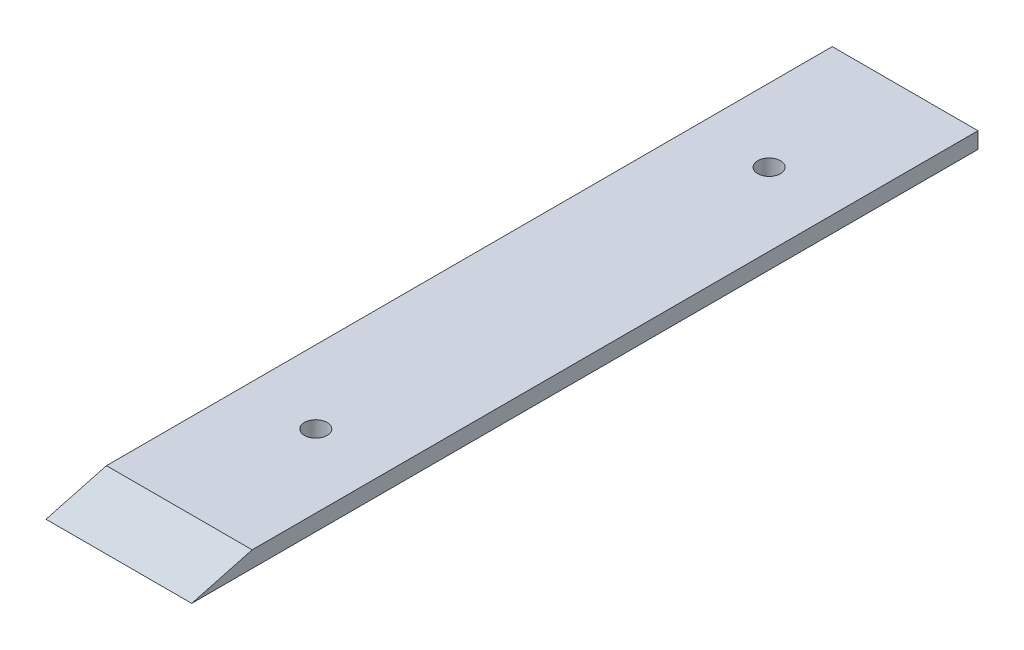
from build123d import *

# Parameters (mm, degrees)
SKETCH_1_W               = 45
SKETCH_1_H               = 5
EXTRUDE_1_DEPTH          = 242.8
CUT_EXTRUDE_2_DEPTH      = 244.891553769
CUT_EXTRUDE_2_DEPTH_BACK = 244.891553769
SKETCH_3_R               = 3.5
CUT_EXTRUDE_3_DEPTH      = 247.947545037
CUT_EXTRUDE_3_DEPTH_BACK = 247.947545037


with BuildPart() as part:
    # Эскиз1 → Бобышка-Вытянуть1 (new body)
    with BuildSketch(Plane.XY):
        Rectangle(SKETCH_1_W, SKETCH_1_H)
    extrude(amount=EXTRUDE_1_DEPTH)

    # Эскиз3 → Вырез-Вытянуть2 (cut, two sides: drawn at the far end of the back side and taken through both)
    with BuildSketch(Plane(origin=(0, 2.5, 0), x_dir=(1, 0, 0), z_dir=(0, 1, 0)).offset(-CUT_EXTRUDE_2_DEPTH_BACK)):
        with Locations(Location((0, -42, 0), (0, 0, 270))):
            Circle(SKETCH_3_R)
        with Locations(Location((0, -182, 0), (0, 0, 270))):
            Circle(SKETCH_3_R)
        with Locations((0, -322)):
            Circle(SKETCH_3_R)
        with Locations((0, -462)):
            Circle(SKETCH_3_R)
        with Locations((0, -602)):
            Circle(SKETCH_3_R)
        with Locations((0, -742)):
            Circle(SKETCH_3_R)
        with Locations((0, -882)):
            Circle(SKETCH_3_R)
        with Locations((0, -1022)):
            Circle(SKETCH_3_R)
        with Locations((0, -1162)):
            Circle(SKETCH_3_R)
        with Locations((0, -1302)):
            Circle(SKETCH_3_R)
    extrude(amount=CUT_EXTRUDE_2_DEPTH + CUT_EXTRUDE_2_DEPTH_BACK, mode=Mode.SUBTRACT)

    # Эскиз4 → Вырез-Вытянуть3 (cut, two sides: drawn at the far end of the back side and taken through both)
    with BuildSketch(Plane.ZY.offset(22.5).offset(-CUT_EXTRUDE_3_DEPTH_BACK)):
        Polygon((242.8, -2.5), (224.139745962, 2.5), (242.8, 2.5), align=None)
    extrude(amount=CUT_EXTRUDE_3_DEPTH + CUT_EXTRUDE_3_DEPTH_BACK, mode=Mode.SUBTRACT)


solid = part.part
